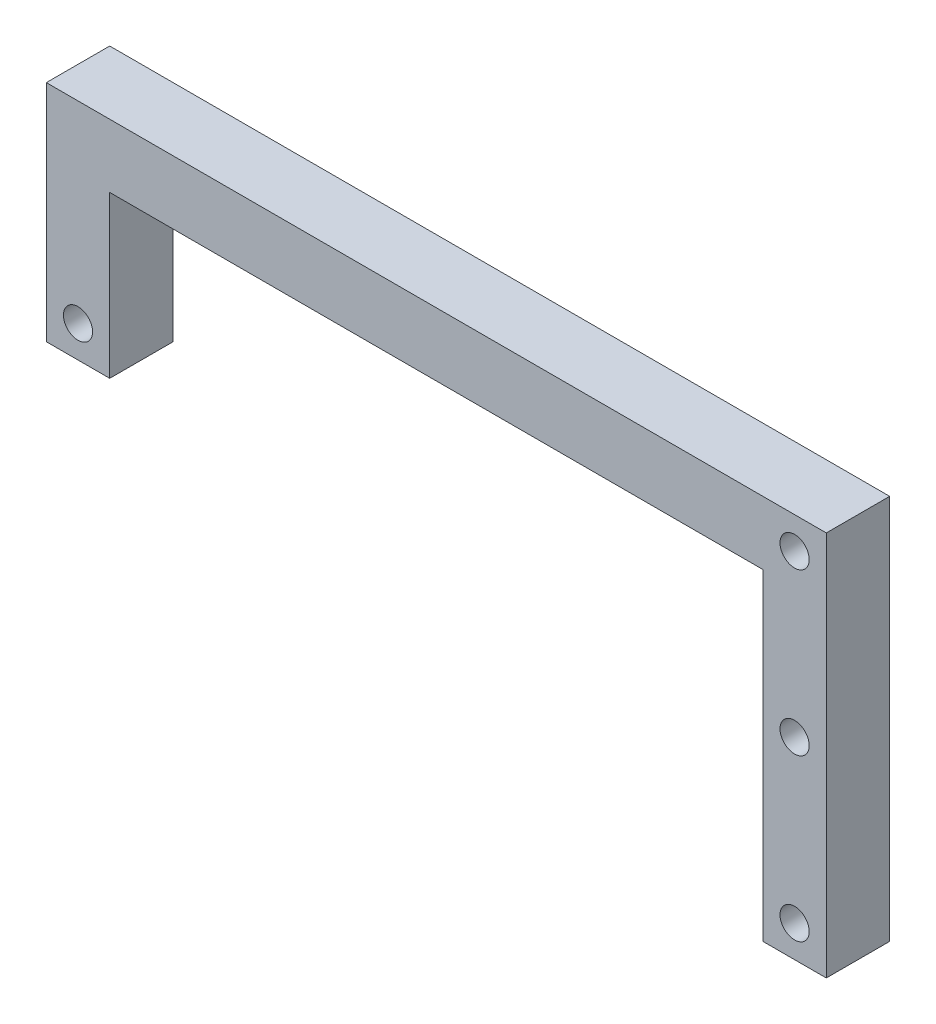
from build123d import *

# Parameters (mm, degrees)
SKETCH1_R           = 2.3
BOSS_EXTRUDE1_DEPTH = 10


with BuildPart() as part:
    # Sketch1 → Boss-Extrude1 (new body)
    with BuildSketch(Plane.XY):
        Polygon((108.03, -30.4), (118.03, -30.4), (118.03, 30.4), (-5, 30.4), (-5, -5), (5, -5), (5, 20.4), (108.03, 20.4), align=None)
        Circle(SKETCH1_R, mode=Mode.SUBTRACT)
        with Locations((113.03, 0)):
            Circle(SKETCH1_R, mode=Mode.SUBTRACT)
        with Locations((113.03, -25.4)):
            Circle(SKETCH1_R, mode=Mode.SUBTRACT)
        with Locations((113.03, 25.4)):
            Circle(SKETCH1_R, mode=Mode.SUBTRACT)
    extrude(amount=BOSS_EXTRUDE1_DEPTH)


solid = part.part
